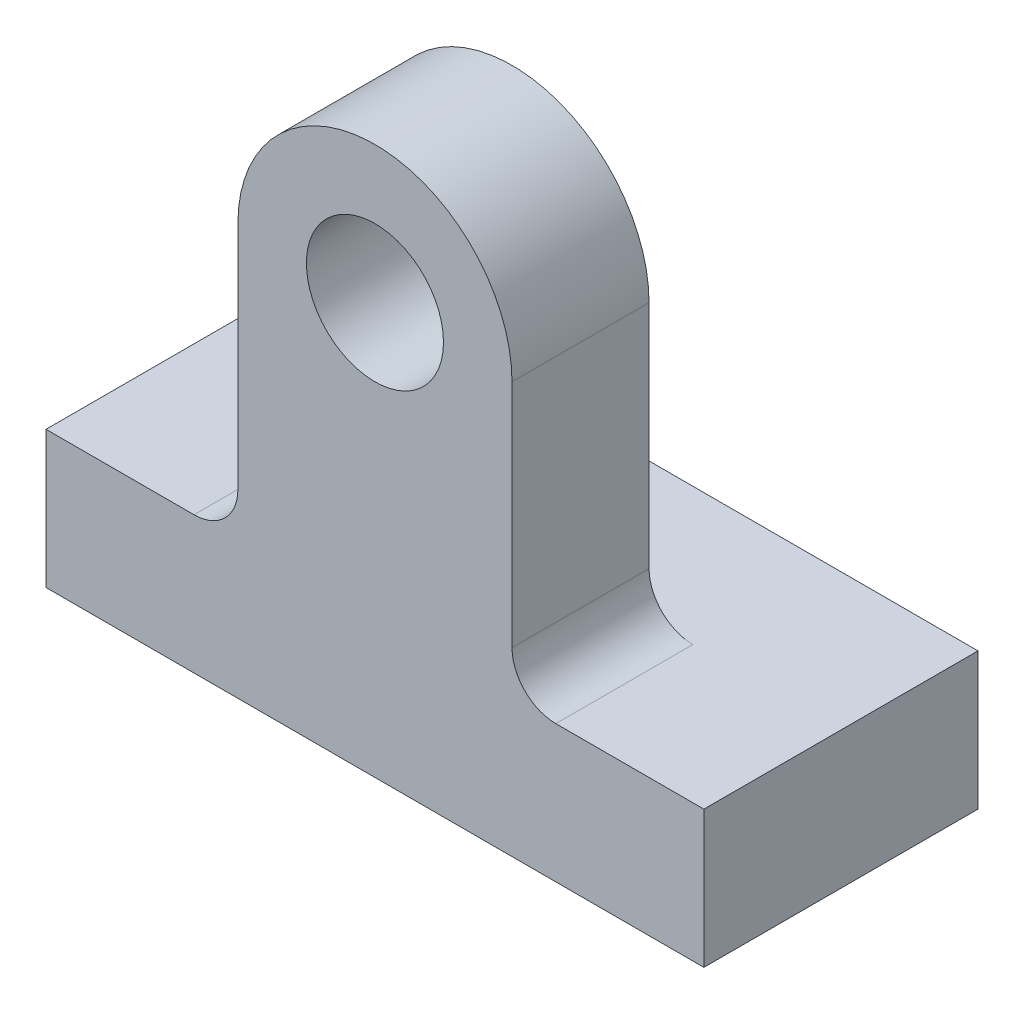
from build123d import *

# Parameters (mm, degrees)
RECTANGLE_SKETCH_W           = 3048
RECTANGLE_SKETCH_H           = 1270
RECTANGLEEXTRUDE_DEPTH       = 635
CURVEDRECTANGLESKETCH_R      = 317.5
CURVEDRECTANGLEEXTRUDE_DEPTH = 635
CURVEDRECTANGLEFILLET_R      = 203.2


with BuildPart() as part:
    # Rectangle Sketch → RectangleExtrude (new body)
    with BuildSketch(Plane(origin=(0, 0, 0), x_dir=(1, 0, 0), z_dir=(0, 1, 0))):
        with Locations((1524, -635)):
            Rectangle(RECTANGLE_SKETCH_W, RECTANGLE_SKETCH_H)
    extrude(amount=RECTANGLEEXTRUDE_DEPTH)

    # CurvedRectangleSketch → CurvedRectangleExtrude (add)
    with BuildSketch(Plane.XY.offset(1270)):
        with BuildLine():
            Line((889, 635), (889, 1905))
            ThreePointArc((889, 1905), (1524, 2540), (2159, 1905))
            Line((2159, 1905), (2159, 635))
            Line((2159, 635), (889, 635))
        make_face()
        with Locations((1524, 1905)):
            Circle(CURVEDRECTANGLESKETCH_R, mode=Mode.SUBTRACT)
    extrude(amount=-CURVEDRECTANGLEEXTRUDE_DEPTH)

    # CurvedRectangleFillet
    curvedrectanglefillet_edges = [part.edges().sort_by_distance(p)[0] for p in [
        (889, 635, 952.5),
        (2159, 635, 952.5),
    ]]
    fillet(curvedrectanglefillet_edges, radius=CURVEDRECTANGLEFILLET_R)


solid = part.part
